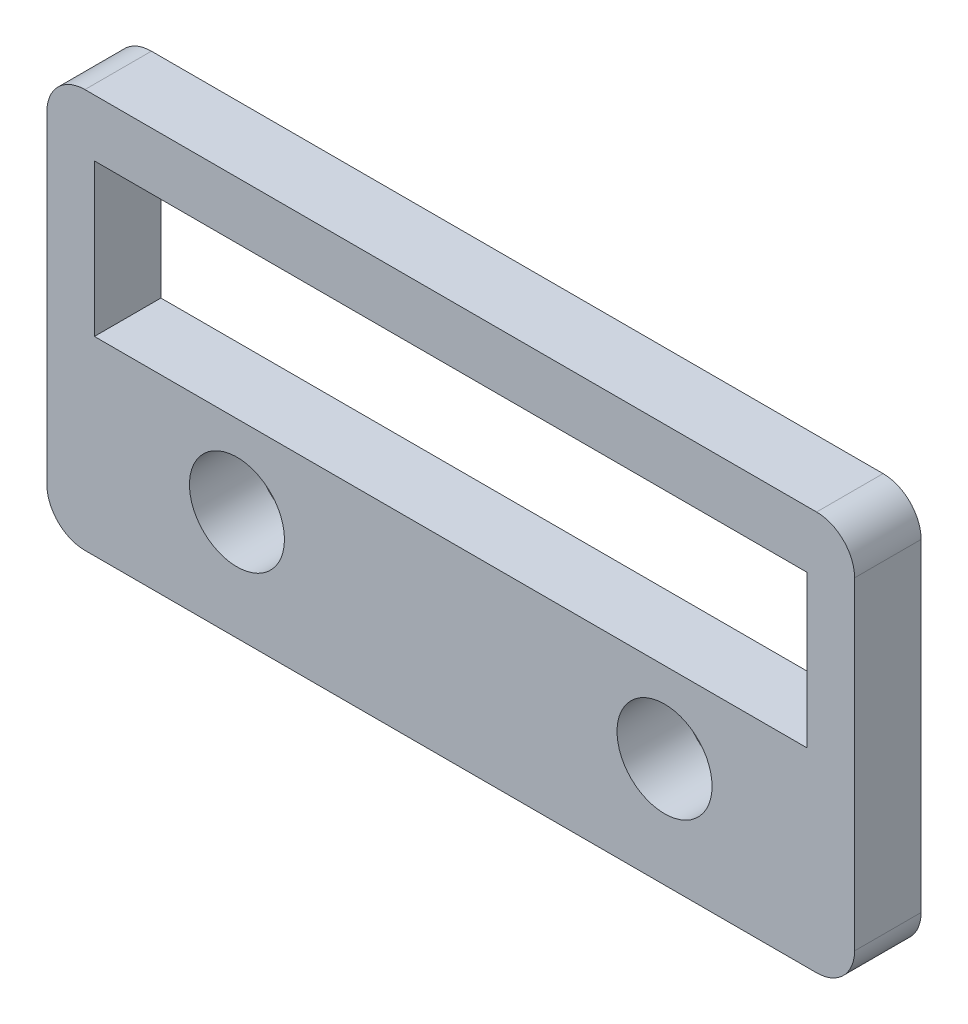
from build123d import *

# Parameters (mm, degrees)
BOSS_EXTRUDE1_DEPTH = 7
SKETCH2_W           = 75
SKETCH2_H           = 16
CUT_EXTRUDE1_DEPTH  = 7
SKETCH3_R           = 5
CUT_EXTRUDE2_DEPTH  = 7


with BuildPart() as part:
    # Sketch1 → Boss-Extrude1 (new body)
    with BuildSketch(Plane.XY):
        with BuildLine():
            Line((-29.304093567, 27.587719298), (47.695906433, 27.587719298))
            ThreePointArc((47.695906433, 27.587719298), (50.524333557, 26.416146423), (51.695906433, 23.587719298))
            Line((51.695906433, 23.587719298), (51.695906433, -10.412280702))
            ThreePointArc((51.695906433, -10.412280702), (50.524333557, -13.240707827), (47.695906433, -14.412280702))
            Line((47.695906433, -14.412280702), (-29.304093567, -14.412280702))
            ThreePointArc((-29.304093567, -14.412280702), (-32.132520692, -13.240707827), (-33.304093567, -10.412280702))
            Line((-33.304093567, -10.412280702), (-33.304093567, 23.587719298))
            ThreePointArc((-33.304093567, 23.587719298), (-32.132520692, 26.416146423), (-29.304093567, 27.587719298))
        make_face()
    extrude(amount=BOSS_EXTRUDE1_DEPTH)

    # Sketch2 → Cut-Extrude1 (cut)
    with BuildSketch(Plane.XY.offset(7)):
        with Locations((9.195906433, 13.587719298)):
            Rectangle(SKETCH2_W, SKETCH2_H)
    extrude(amount=-CUT_EXTRUDE1_DEPTH, mode=Mode.SUBTRACT)

    # Sketch3 → Cut-Extrude2 (cut)
    with BuildSketch(Plane.XY.offset(7)):
        with Locations((31.695906433, -2.912280702)):
            Circle(SKETCH3_R)
        with Locations((-13.304093567, -2.912280702)):
            Circle(SKETCH3_R)
    extrude(amount=-CUT_EXTRUDE2_DEPTH, mode=Mode.SUBTRACT)


solid = part.part
